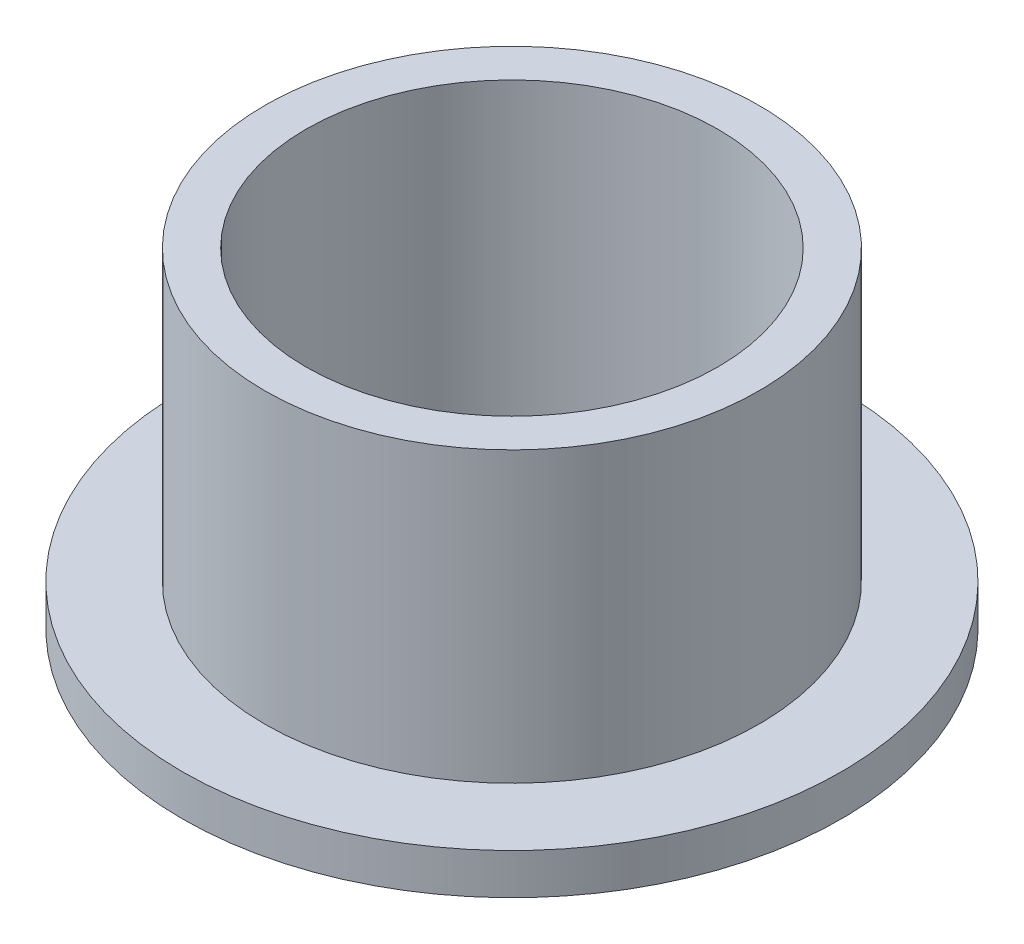
from build123d import *


with BuildPart() as part:
    # Sketch1 → Revolve1 (revolve)
    with BuildSketch(Plane.XY, mode=Mode.PRIVATE) as revolve1_sk:
        Polygon((7.9375, 0), (12.7, 0), (12.7, 1.5748), (9.525, 1.5748), (9.525, 12.7), (7.9375, 12.7), align=None)
    revolve(revolve1_sk.sketch.rotate(Axis((0, 26.712740385, 0), (0, -1, 0)), 90), axis=Axis((0, 26.712740385, 0), (0, -1, 0)))


solid = part.part
